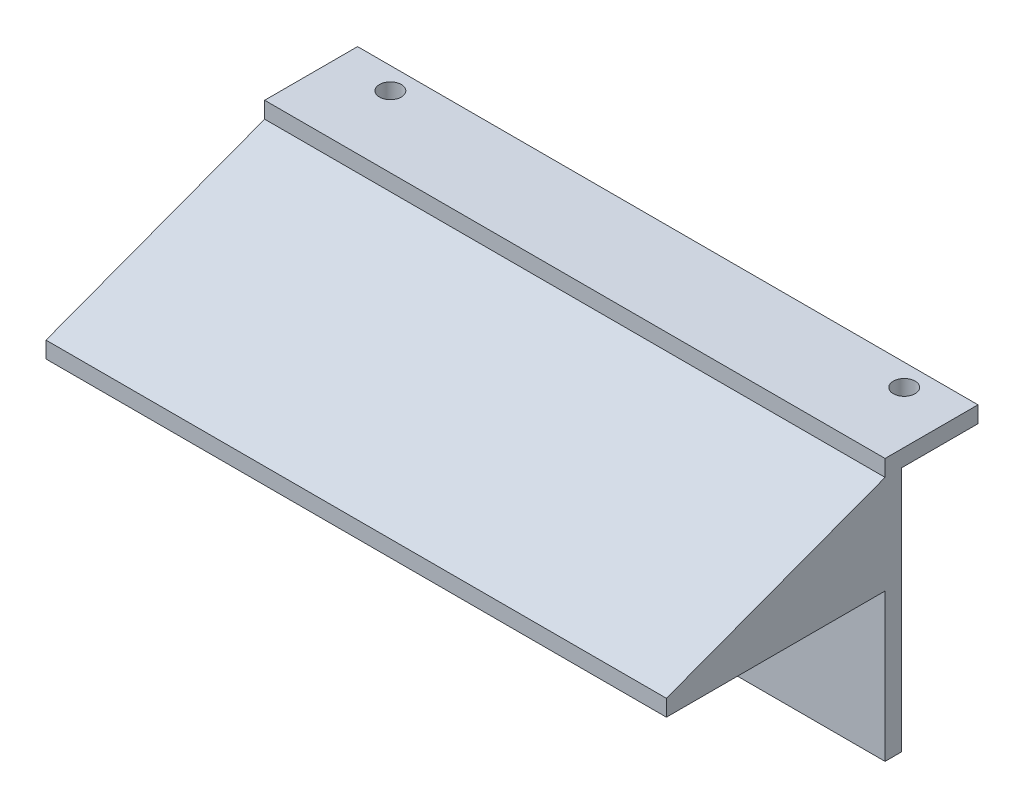
from build123d import *

# Parameters (mm, degrees)
BOSS_EXTRU_1_DEPTH      = 3
ESQUISSE2_W             = 113.5
ESQUISSE2_H             = 3
ESQUISSE2_H_2           = 45
BOSS_EXTRU_2_DEPTH      = 3
ESQUISSE3_W             = 113.5
ESQUISSE3_H             = 18
BOSS_EXTRU_3_DEPTH      = 40
ENL_V_MAT_EXTRU_1_DEPTH = 132.114678423


with BuildPart() as part:
    # Esquisse1 → Boss.-Extru.1 (new body)
    with BuildSketch(Plane(origin=(0, 0, 0), x_dir=(1, 0, 0), z_dir=(0, 1, 0))):
        with BuildLine():
            Line((-46.879360142, 43.789213198), (-39.379360142, 43.789213198))
            Line((-39.379360142, 43.789213198), (-39.379360142, 47.789213198))
            Line((-39.379360142, 47.789213198), (-152.879360142, 47.789213198))
            Line((-152.879360142, 47.789213198), (-152.879360142, 43.789213198))
            Line((-152.879360142, 43.789213198), (-144.879360142, 43.789213198))
            ThreePointArc((-144.879360142, 43.789213198), (-142.879360142, 45.789213198), (-140.879360142, 43.789213198))
            Line((-140.879360142, 43.789213198), (-50.879360142, 43.789213198))
            ThreePointArc((-50.879360142, 43.789213198), (-48.879360142, 45.789213198), (-46.879360142, 43.789213198))
        make_face()
        with BuildLine():
            Line((-39.379360142, 33.789213198), (-39.379360142, 43.789213198))
            Line((-39.379360142, 43.789213198), (-46.879360142, 43.789213198))
            ThreePointArc((-46.879360142, 43.789213198), (-48.879360142, 41.789213198), (-50.879360142, 43.789213198))
            Line((-50.879360142, 43.789213198), (-140.879360142, 43.789213198))
            ThreePointArc((-140.879360142, 43.789213198), (-142.879360142, 41.789213198), (-144.879360142, 43.789213198))
            Line((-144.879360142, 43.789213198), (-152.879360142, 43.789213198))
            Line((-152.879360142, 43.789213198), (-152.879360142, 33.789213198))
            Line((-152.879360142, 33.789213198), (-39.379360142, 33.789213198))
        make_face()
    extrude(amount=BOSS_EXTRU_1_DEPTH)

    # Esquisse2 → Boss.-Extru.2 (add)
    with BuildSketch(Plane.XY.offset(-33.789213198)):
        with Locations((-96.129360142, 1.5)):
            Rectangle(ESQUISSE2_W, ESQUISSE2_H)
        with Locations((-96.129360142, -22.5)):
            Rectangle(ESQUISSE2_W, ESQUISSE2_H_2)
    extrude(amount=BOSS_EXTRU_2_DEPTH)

    # Esquisse3 → Boss.-Extru.3 (add)
    with BuildSketch(Plane.XY.offset(-30.789213198)):
        with Locations((-96.129360142, -9)):
            Rectangle(ESQUISSE3_W, ESQUISSE3_H)
    extrude(amount=BOSS_EXTRU_3_DEPTH)

    # Esquisse5 → Enlèv. mat.-Extru.1 (cut, through all)
    with BuildSketch(Plane.ZY.offset(152.879360142)):
        Polygon((-30.789213198, 0), (9.210786802, -15), (9.210786802, 0), align=None)
    extrude(amount=-ENL_V_MAT_EXTRU_1_DEPTH, mode=Mode.SUBTRACT)


solid = part.part
